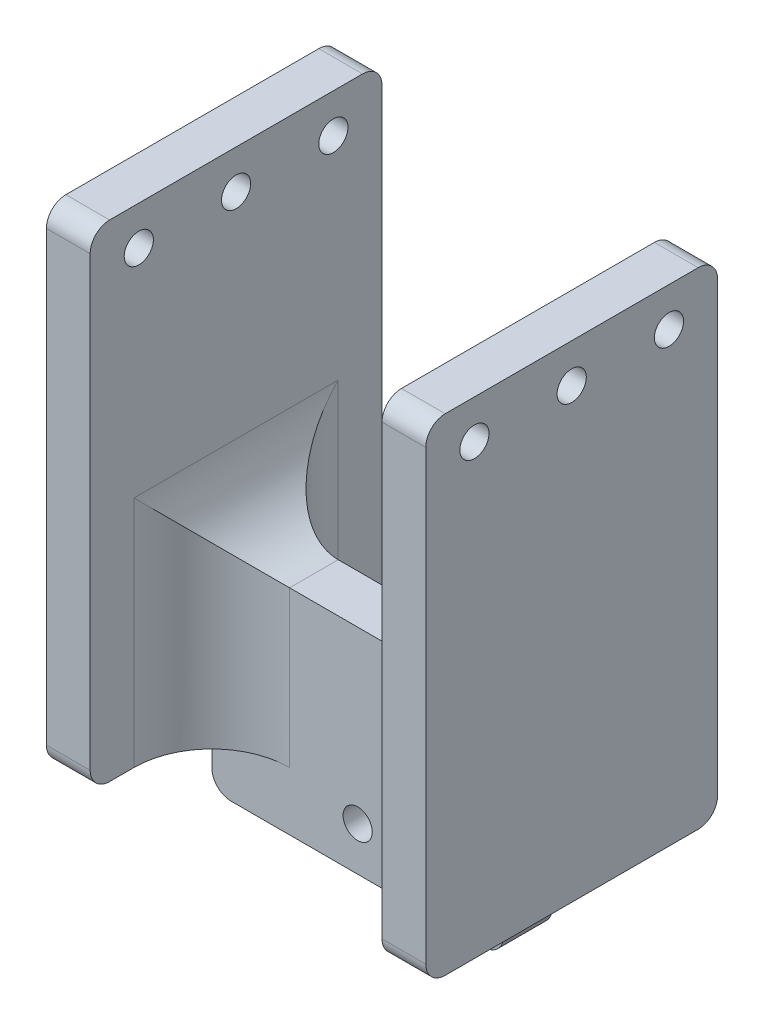
from build123d import *

# Parameters (mm, degrees)
SKETCH_1_W          = 30
SKETCH_1_H          = 50
EXTRUDE_1_DEPTH     = 5
SKETCH_5_W          = 30
SKETCH_5_H          = 50
EXTRUDE_2_DEPTH     = 4.5
SKETCH_6_R          = 1.5
CUT_EXTRUDE_1_DEPTH = 73.857738093
SKETCH_7_R          = 1.5
CUT_EXTRUDE_2_DEPTH = 73.857738093
SKETCH_10_R         = 1.5
CUT_EXTRUDE_3_DEPTH = 65.556177086
SKETCH_11_W         = 30
SKETCH_11_H         = 28
CUT_EXTRUDE_4_DEPTH = 65.556177086
FILLET_1_R          = 8
FILLET_2_R          = 8
FILLET_3_R          = 2


with BuildPart() as part:
    # 草图1 → 凸台-拉伸1 (new body)
    with BuildSketch(Plane.XY):
        Rectangle(SKETCH_1_W, SKETCH_1_H)
    extrude(amount=EXTRUDE_1_DEPTH)

    # 草图5 → 凸台-拉伸2 (add)
    with BuildSketch(Plane.ZY.offset(15)):
        with Locations((2.5, 34)):
            Rectangle(SKETCH_5_W, SKETCH_5_H)
    extrude_2 = extrude(amount=EXTRUDE_2_DEPTH)

    # 镜向1: 凸台-拉伸2 across plane
    add(extrude_2.mirror(Plane(origin=(0, 0, 0), x_dir=(0, 0, 1), z_dir=(1, 0, 0))))

    # 草图6 → 切除-拉伸1 (cut, through all)
    with BuildSketch(Plane.ZY.offset(19.5)):
        with Locations((2.5, 55)):
            Circle(SKETCH_6_R)
    extrude(amount=-CUT_EXTRUDE_1_DEPTH, mode=Mode.SUBTRACT)

    # 草图7 → 切除-拉伸2 (cut, through all)
    with BuildSketch(Plane.ZY.offset(19.5)):
        with Locations((-7.5, 55)):
            Circle(SKETCH_7_R)
        with Locations((12.5, 55)):
            Circle(SKETCH_7_R)
    extrude(amount=-CUT_EXTRUDE_2_DEPTH, mode=Mode.SUBTRACT)

    # 草图10 → 切除-拉伸3 (cut, through all)
    with BuildSketch(Plane(origin=(0, 0, 0), x_dir=(-1, 0, 0), z_dir=(0, 0, -1))):
        with Locations((0, -13.5)):
            Circle(SKETCH_10_R)
        with Locations((0, 7.5)):
            Circle(SKETCH_10_R)
    extrude(amount=-CUT_EXTRUDE_3_DEPTH, mode=Mode.SUBTRACT)

    # 草图11 → 切除-拉伸4 (cut, through all)
    with BuildSketch(Plane(origin=(0, 0, 0), x_dir=(-1, 0, 0), z_dir=(0, 0, -1))):
        with Locations((0, -11)):
            Rectangle(SKETCH_11_W, SKETCH_11_H)
    extrude(amount=-CUT_EXTRUDE_4_DEPTH, mode=Mode.SUBTRACT)

    # 圆角1
    fillet_1_edges = [part.edges().sort_by_distance(p)[0] for p in [
        (15, 17, 0),
        (15, 17, 5),
        (-15, 17, 5),
        (-15, 17, 0),
    ]]
    fillet(fillet_1_edges, radius=FILLET_1_R)

    # 圆角2
    fillet_2_edges = [part.edges().sort_by_distance(p)[0] for p in [
        (-15, 25, 2.5),
        (15, 25, 2.5),
    ]]
    fillet(fillet_2_edges, radius=FILLET_2_R)

    # 圆角3
    fillet_3_edges = [part.edges().sort_by_distance(p)[0] for p in [
        (-15, 3, 2.5),
        (15, 3, 2.5),
        (-17.25, 59, -12.5),
        (-17.25, 9, -12.5),
        (-17.25, 9, 17.5),
        (-17.25, 59, 17.5),
        (17.25, 9, -12.5),
        (17.25, 59, -12.5),
        (17.25, 59, 17.5),
        (17.25, 9, 17.5),
    ]]
    fillet(fillet_3_edges, radius=FILLET_3_R)


solid = part.part
